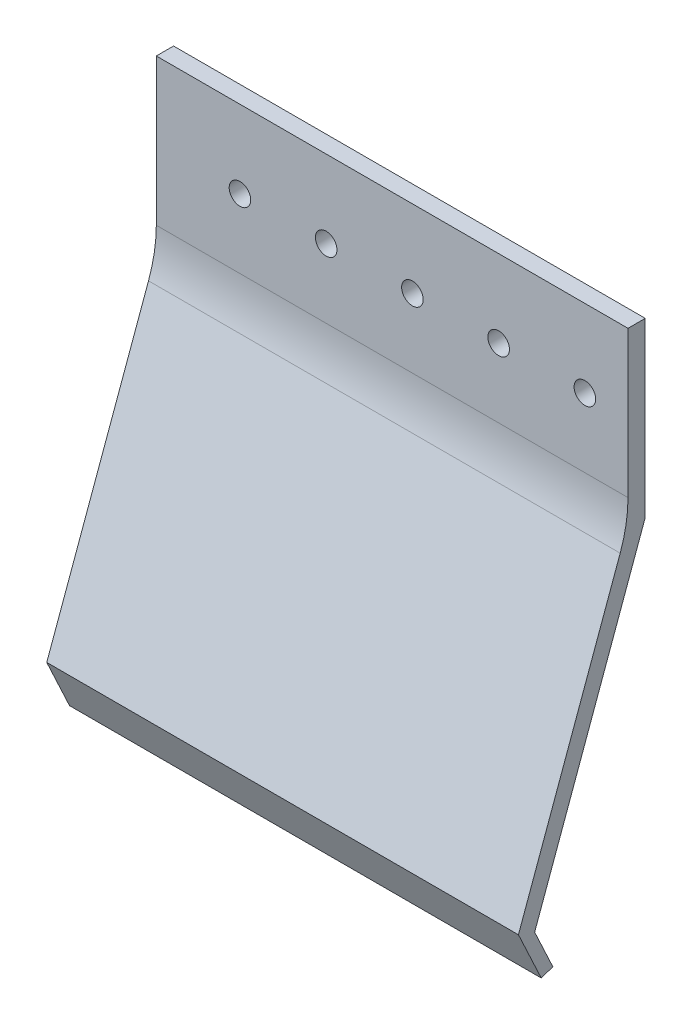
from build123d import *

# Parameters (mm, degrees)
SKETCH1_W           = 109.4
SKETCH1_H           = 109.4
SKETCH1_W_2         = 79.4
SKETCH1_H_2         = 79.4
SKETCH1_R           = 6
SKETCH1_R_2         = 1.5
BOSS_EXTRUDE1_DEPTH = 8
BOSS_EXTRUDE2_DEPTH = 109.4
FILLET1_R           = 30
SKETCH5_W           = 8
SKETCH5_H           = 149.4
BOSS_EXTRUDE3_DEPTH = 109.4
SKETCH3_W           = 8
SKETCH3_H           = 109.4
CUT_EXTRUDE4_DEPTH  = 135
SKETCH7_W           = 8
SKETCH7_H           = 40
CUT_EXTRUDE5_DEPTH  = 135
SKETCH4_R           = 2.5
CUT_EXTRUDE6_DEPTH  = 10


with BuildPart() as part:
    # Sketch1 → Boss-Extrude1 (new body)
    # profile 1 of 2: a face of its own
    with BuildSketch(Plane.XY):
        with Locations((-17.5, 17.5)):
            Rectangle(SKETCH1_W, SKETCH1_H)
        with Locations((-17.5, 17.5)):
            Rectangle(SKETCH1_W_2, SKETCH1_H_2, mode=Mode.SUBTRACT)
    # profile 2 of 2: a face of its own
    with BuildSketch(Plane.XY):
        with Locations((-17.5, 17.5)):
            Rectangle(SKETCH1_W_2, SKETCH1_H_2)
        with Locations((-35, 0)):
            Circle(SKETCH1_R, mode=Mode.SUBTRACT)
        Circle(SKETCH1_R, mode=Mode.SUBTRACT)
        with Locations((0, 35)):
            Circle(SKETCH1_R, mode=Mode.SUBTRACT)
        with Locations((-35, 35)):
            Circle(SKETCH1_R, mode=Mode.SUBTRACT)
        with Locations((-52.809903828, -17.809903828)):
            Circle(SKETCH1_R_2, mode=Mode.SUBTRACT)
        with Locations((-17.5, -17.5)):
            Circle(SKETCH1_R_2, mode=Mode.SUBTRACT)
        with Locations((17.5, -17.5)):
            Circle(SKETCH1_R_2, mode=Mode.SUBTRACT)
        with Locations((17.5, 17.5)):
            Circle(SKETCH1_R_2, mode=Mode.SUBTRACT)
        with Locations((-17.5, 17.5)):
            Circle(SKETCH1_R_2, mode=Mode.SUBTRACT)
        with Locations((-52.5, 17.5)):
            Circle(SKETCH1_R_2, mode=Mode.SUBTRACT)
        with Locations((17.5, 52.5)):
            Circle(SKETCH1_R_2, mode=Mode.SUBTRACT)
        with Locations((-17.5, 52.5)):
            Circle(SKETCH1_R_2, mode=Mode.SUBTRACT)
        with Locations((-52.5, 52.5)):
            Circle(SKETCH1_R_2, mode=Mode.SUBTRACT)
    extrude(amount=BOSS_EXTRUDE1_DEPTH)



with BuildPart() as body_2:
    # Sketch2 → Boss-Extrude2 (new body)
    with BuildSketch(Plane(origin=(37.2, 0, 0), x_dir=(0, 0, -1), z_dir=(1, 0, 0))):
        Polygon((-8, 72.2), (-33.651510749, 1.723053441), (-29.425328132, -7.340024429), (-32.127552961, -8.237713324), (-37.410281233, 3.091134014), (-12, 72.905307923), (-12, 112.2), (-8, 112.2), align=None)
    extrude(amount=-BOSS_EXTRUDE2_DEPTH)

    # Fillet1
    fillet1_edges = [body_2.edges().sort_by_distance(p)[0] for p in [
        (-17.5, 72.905307923, 12),
    ]]
    fillet(fillet1_edges, radius=FILLET1_R)


with BuildPart() as part_1:
    add(part.part)

    add(body_2.part)  # Boss-Extrude3 merges body 2
    # Sketch5 → Boss-Extrude3 (add)
    with BuildSketch(Plane(origin=(37.2, 0, 0), x_dir=(0, 0, -1), z_dir=(1, 0, 0))):
        with Locations((-4, 37.5)):
            Rectangle(SKETCH5_W, SKETCH5_H)
    extrude(amount=-BOSS_EXTRUDE3_DEPTH)

    # Sketch3 → Cut-Extrude4 (cut)
    with BuildSketch(Plane(origin=(37.2, 0, 0), x_dir=(0, 0, -1), z_dir=(1, 0, 0))):
        with Locations((-4, 17.5)):
            Rectangle(SKETCH3_W, SKETCH3_H)
    extrude(amount=-CUT_EXTRUDE4_DEPTH, mode=Mode.SUBTRACT)

    # Sketch7 → Cut-Extrude5 (cut)
    with BuildSketch(Plane(origin=(37.2, 0, 0), x_dir=(0, 0, -1), z_dir=(1, 0, 0))):
        with Locations((-4, 92.2)):
            Rectangle(SKETCH7_W, SKETCH7_H)
    extrude(amount=-CUT_EXTRUDE5_DEPTH, mode=Mode.SUBTRACT)

    # Sketch4 → Cut-Extrude6 (cut)
    with BuildSketch(Plane.XY.offset(12)):
        with Locations((-52.8, 94.2)):
            Circle(SKETCH4_R)
        with Locations((-32.8, 94.2)):
            Circle(SKETCH4_R)
        with Locations((-12.8, 94.2)):
            Circle(SKETCH4_R)
        with Locations((7.2, 94.2)):
            Circle(SKETCH4_R)
        with Locations((27.2, 94.2)):
            Circle(SKETCH4_R)
    extrude(amount=-CUT_EXTRUDE6_DEPTH, mode=Mode.SUBTRACT)


solid = part_1.part
